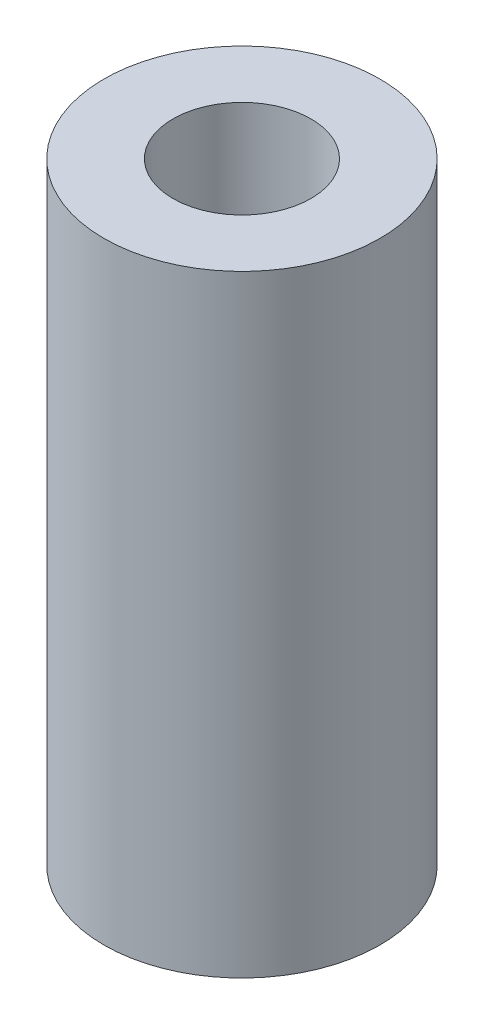
from build123d import *

# Parameters (mm, degrees)
SKETCH1_R           = 4.5
SKETCH1_R_2         = 2.25
BOSS_EXTRUDE1_DEPTH = 19.95


with BuildPart() as part:
    # Sketch1 → Boss-Extrude1 (new body)
    with BuildSketch(Plane(origin=(0, 0, 0), x_dir=(1, 0, 0), z_dir=(0, 1, 0))):
        with Locations(Location((0, 0, 0), (0, 0, 270))):
            Circle(SKETCH1_R)
        with Locations(Location((0, 0, 0), (0, 0, 270))):
            Circle(SKETCH1_R_2, mode=Mode.SUBTRACT)
    extrude(amount=BOSS_EXTRUDE1_DEPTH)


solid = part.part
